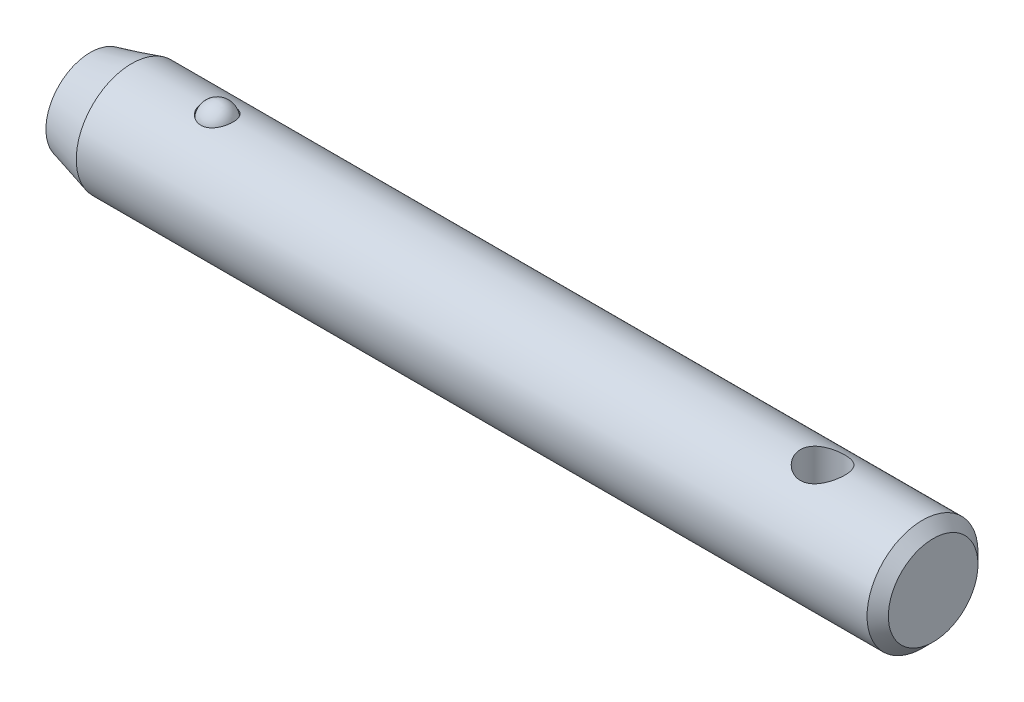
from build123d import *

# Parameters (mm, degrees)
SKETCH4_W = 0.79375
SKETCH4_H = 3.96875


with BuildPart() as part:
    # Sketch1 → Revolve1 (revolve)
    with BuildSketch(Plane.XY, mode=Mode.PRIVATE) as revolve1_sk:
        Polygon((15.0749, 1.603375), (14.6939, 1.984375), (-13.593742336, 1.984375), (-15.0749, 1.5875), (-15.0749, 0), (15.0749, 0), align=None)
    revolve(revolve1_sk.sketch.rotate(Axis((39.811445486, 0, 0), (-1, 0, 0)), 90), axis=Axis((39.811445486, 0, 0), (-1, 0, 0)))

    # Sketch2 → Cut-Revolve1 (revolve, cut)
    with BuildSketch(Plane.XY):
        with BuildLine():
            Line((-9.934047917, 1.7859375), (-11.131022917, 1.7859375))
            ThreePointArc((-11.131022917, 1.7859375), (-10.532535417, 2.384425), (-9.934047917, 1.7859375))
        make_face()
    revolve(axis=Axis((-9.934047917, 1.7859375, 0), (1, 0, 0)), mode=Mode.SUBTRACT)

    # Sketch4 → Cut-Revolve2 (revolve, cut)
    with BuildSketch(Plane.XY, mode=Mode.PRIVATE) as cut_revolve2_sk:
        with Locations((11.515725, 0)):
            Rectangle(SKETCH4_W, SKETCH4_H)
    revolve(cut_revolve2_sk.sketch.rotate(Axis((11.11885, -1.984375, 0), (0, 1, 0)), 90), axis=Axis((11.11885, -1.984375, 0), (0, 1, 0)), mode=Mode.SUBTRACT)


with BuildPart() as body_2:
    # Sketch3 → Revolve2 (revolve)
    with BuildSketch(Plane.XY):
        with BuildLine():
            Line((-9.959447917, 1.7859375), (-11.105622917, 1.7859375))
            ThreePointArc((-11.105622917, 1.7859375), (-10.532535417, 2.359025), (-9.959447917, 1.7859375))
        make_face()
    revolve(axis=Axis((-9.959447917, 1.7859375, 0), (1, 0, 0)))


solid = Compound([part.part, body_2.part])
